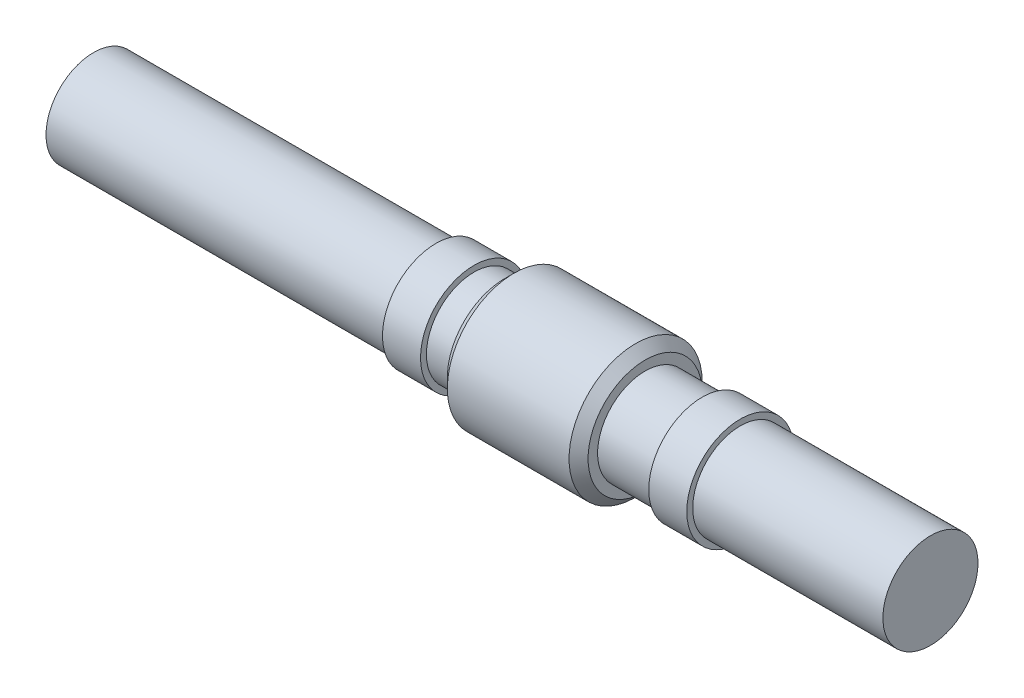
from build123d import *

# Parameters (mm, degrees)
CROQUIS1_R              = 35
SALIENTE_EXTRUIR1_DEPTH = 37
CHAFL_N1_SIZE           = 5
CROQUIS2_R              = 25
SALIENTE_EXTRUIR2_DEPTH = 16
CROQUIS3_R              = 28.1
SALIENTE_EXTRUIR3_DEPTH = 120
SALIENTE_EXTRUIR4_START = 30
CROQUIS4_R              = 25
SALIENTE_EXTRUIR4_DEPTH = 30
SALIENTE_EXTRUIR5_START = 120
CROQUIS5_R              = 28.1
SALIENTE_EXTRUIR5_DEPTH = 120
CORTAR_EXTRUIR1_START   = -100
CROQUIS6_R              = 28.1
CROQUIS6_R_2            = 25
CORTAR_EXTRUIR1_DEPTH   = 100
CROQUIS8_R              = 28.1
CROQUIS8_R_2            = 25
CORTAR_EXTRUIR2_DEPTH   = 100
CROQUIS9_R              = 25
SALIENTE_EXTRUIR6_DEPTH = 80


with BuildPart() as part:
    # Croquis1 → Saliente-Extruir1 (new, symmetric)
    with BuildSketch(Plane(origin=(0, 0, 0), x_dir=(0, 0, -1), z_dir=(1, 0, 0))):
        Circle(CROQUIS1_R)
    extrude(amount=SALIENTE_EXTRUIR1_DEPTH, both=True)

    # Chaflán1
    chafl_n1_edges = [part.edges().sort_by_distance(p)[0] for p in [
        (-37, 0, 35),
        (37, 0, 35),
    ]]
    chamfer(chafl_n1_edges, length=CHAFL_N1_SIZE)

    # Croquis2 → Saliente-Extruir2 (add)
    with BuildSketch(Plane.ZY.offset(37)):
        Circle(CROQUIS2_R)
    extrude(amount=SALIENTE_EXTRUIR2_DEPTH)

    # Croquis3 → Saliente-Extruir3 (add)
    with BuildSketch(Plane.ZY.offset(53)):
        Circle(CROQUIS3_R)
    extrude(amount=SALIENTE_EXTRUIR3_DEPTH)

    # Croquis4 → Saliente-Extruir4 (add)
    with BuildSketch(Plane(origin=(37, 0, 0), x_dir=(0, 0, -1), z_dir=(1, 0, 0)).offset(SALIENTE_EXTRUIR4_START)):
        with Locations(Location((0, 0, 0), (0, 0, 180))):
            Circle(CROQUIS4_R)
    extrude(amount=-SALIENTE_EXTRUIR4_DEPTH)

    # Croquis5 → Saliente-Extruir5 (add)
    with BuildSketch(Plane(origin=(67, 0, 0), x_dir=(0, 0, -1), z_dir=(1, 0, 0)).offset(SALIENTE_EXTRUIR5_START)):
        with Locations(Location((0, 0, 0), (0, 0, 180))):
            Circle(CROQUIS5_R)
    extrude(amount=-SALIENTE_EXTRUIR5_DEPTH)

    # Croquis6 → Cortar-Extruir1 (cut)
    with BuildSketch(Plane.ZY.offset(173).offset(CORTAR_EXTRUIR1_START)):
        Circle(CROQUIS6_R)
        Circle(CROQUIS6_R_2, mode=Mode.SUBTRACT)
    extrude(amount=CORTAR_EXTRUIR1_DEPTH, mode=Mode.SUBTRACT)

    # Croquis8 → Cortar-Extruir2 (cut)
    with BuildSketch(Plane(origin=(187, 0, 0), x_dir=(0, 0, -1), z_dir=(1, 0, 0))):
        with Locations(Location((0, 0, 0), (0, 0, 180))):
            Circle(CROQUIS8_R)
        with Locations(Location((0, 0, 0), (0, 0, 180))):
            Circle(CROQUIS8_R_2, mode=Mode.SUBTRACT)
    extrude(amount=-CORTAR_EXTRUIR2_DEPTH, mode=Mode.SUBTRACT)

    # Croquis9 → Saliente-Extruir6 (add)
    with BuildSketch(Plane.ZY.offset(173)):
        Circle(CROQUIS9_R)
    extrude(amount=SALIENTE_EXTRUIR6_DEPTH)


solid = part.part
